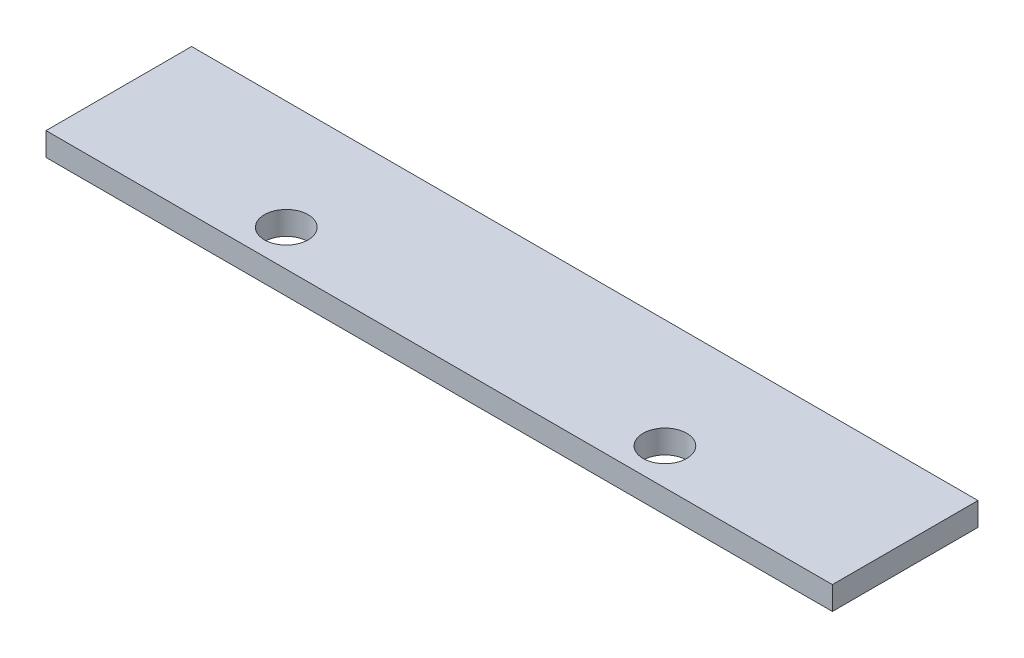
from build123d import *

# Parameters (mm, degrees)
SKETCH1_W           = 54
SKETCH1_H           = 10
SKETCH1_R           = 1.5
BOSS_EXTRUDE1_DEPTH = 1.6


with BuildPart() as part:
    # Sketch1 → Boss-Extrude1 (new body)
    with BuildSketch(Plane(origin=(0, 0, 0), x_dir=(1, 0, 0), z_dir=(0, 1, 0))):
        Rectangle(SKETCH1_W, SKETCH1_H)
        with Locations(Location((-13, -2.5, 0), (0, 0, 270))):
            Circle(SKETCH1_R, mode=Mode.SUBTRACT)
        with Locations(Location((13, -2.5, 0), (0, 0, 270))):
            Circle(SKETCH1_R, mode=Mode.SUBTRACT)
    extrude(amount=BOSS_EXTRUDE1_DEPTH)


solid = part.part
